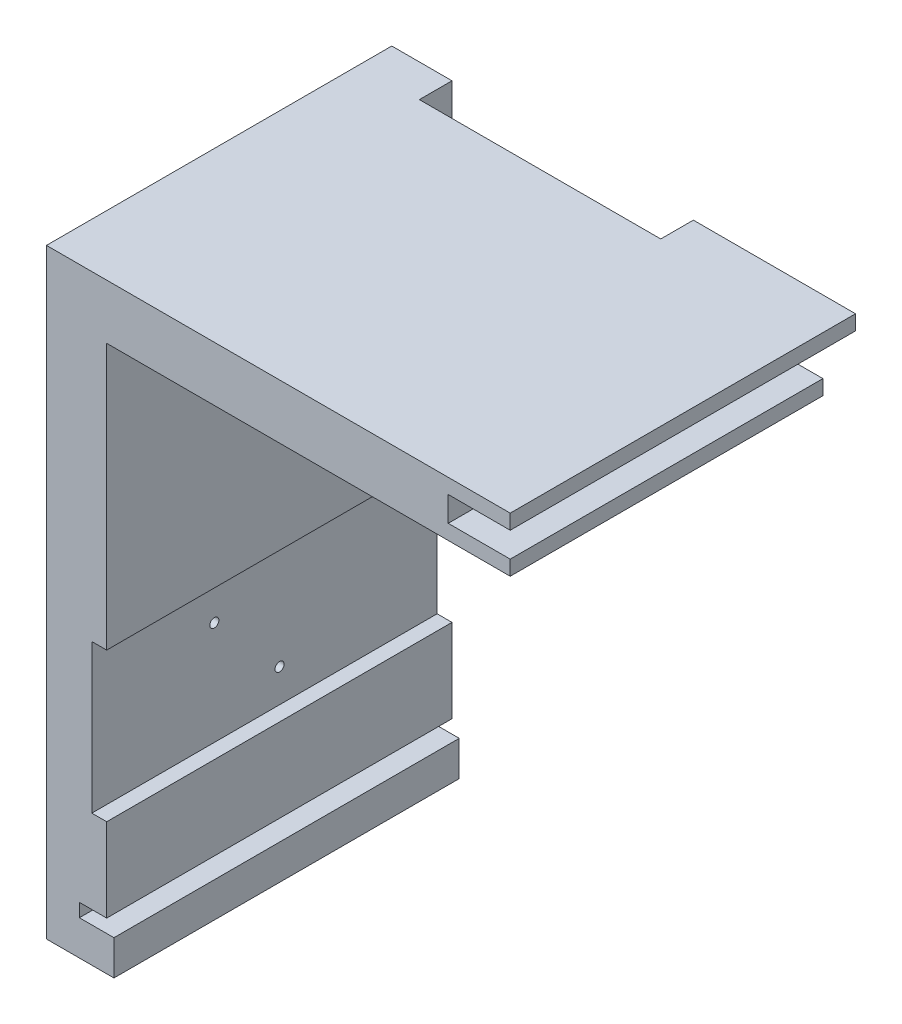
from build123d import *

# Parameters (mm, degrees)
BOSS_EXTRUDE1_DEPTH = 95.25
CUT_EXTRUDE1_DEPTH  = 9
SKETCH5_R           = 1.25
CUT_EXTRUDE2_DEPTH  = 3


with BuildPart() as part:
    # Sketch1 → Boss-Extrude1 (new body)
    with BuildSketch(Plane.XY):
        Polygon((0, 0), (-111.31, 0), (-111.31, -73.29), (-115.41, -73.29), (-115.41, -114.29), (-111.31, -114.29), (-111.31, -137.31), (-118.84, -137.31), (-118.84, -140.99), (-109.31, -140.99), (-109.31, -150.62), (-127.92, -150.62), (-127.92, 15.09), (0, 15.09), (0, 10.99), (-17.1, 10.99), (-17.1, 4.1), (0, 4.1), align=None)
    extrude(amount=BOSS_EXTRUDE1_DEPTH)

    # Sketch4 → Cut-Extrude1 (cut)
    with BuildSketch(Plane(origin=(0, 0, 0), x_dir=(-1, 0, 0), z_dir=(0, 0, -1))):
        Polygon((111.31, 0), (0, 0), (0, 10.99), (44.73, 10.99), (44.73, 15.09), (111.31, 15.09), align=None)
    extrude(amount=-CUT_EXTRUDE1_DEPTH, mode=Mode.SUBTRACT)

    # Sketch5 → Cut-Extrude2 (cut)
    with BuildSketch(Plane(origin=(-115.41, 0, 0), x_dir=(0, 0, -1), z_dir=(1, 0, 0))):
        with Locations((-43.46, -105.21)):
            Circle(SKETCH5_R)
        with Locations((-61.46, -85.71)):
            Circle(SKETCH5_R)
    extrude(amount=-CUT_EXTRUDE2_DEPTH, mode=Mode.SUBTRACT)


solid = part.part
